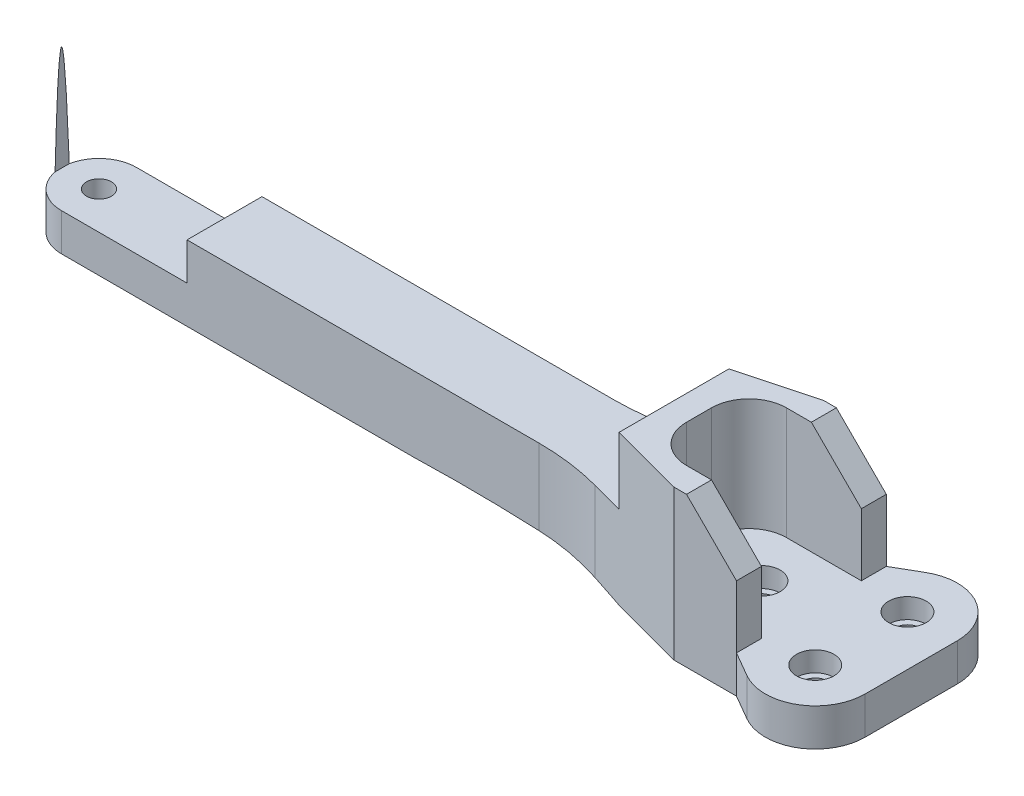
from build123d import *

# Parameters (mm, degrees)
SKETCH1_R                               = 5
BOSS_EXTRUDE1_DEPTH                     = 60
BOSS_EXTRUDE2_START                     = 15
BOSS_EXTRUDE2_DEPTH                     = 15
CBORE_FOR_M5_HEX_HEAD_BOLT1_D           = 10
CBORE_FOR_M5_HEX_HEAD_BOLT1_CBORE_D     = 15
CBORE_FOR_M5_HEX_HEAD_BOLT1_CBORE_DEPTH = 8
CHAMFER1_SIZE                           = 20
CUT_EXTRUDE3_DEPTH                      = 338.769583605


with BuildPart() as part:
    # Sketch1 → Boss-Extrude1 (new body)
    with BuildSketch(Plane(origin=(0, 0, 0), x_dir=(1, 0, 0), z_dir=(0, 1, 0))):
        with BuildLine():
            ThreePointArc((0, 15), (-15, 0), (0, -15))
            Line((0, -15), (179, -15))
            Line((179, -15), (191.125444005, -15))
            ThreePointArc((191.125444005, -15), (204.178063227, -15.855513863), (217.007348515, -18.407417371))
            Line((217.007348515, -18.407417371), (260.271455877, -30))
            Line((260.271455877, -30), (285.271455877, -30))
            Line((285.271455877, -30), (285.271455877, -20))
            Line((285.271455877, -20), (255.271455877, -20))
            ThreePointArc((255.271455877, -20), (244.66485416, -15.606601718), (240.271455877, -5))
            Line((240.271455877, -5), (240.271455877, 5))
            ThreePointArc((240.271455877, 5), (244.66485416, 15.606601718), (255.271455877, 20))
            Line((255.271455877, 20), (285.271455877, 20))
            Line((285.271455877, 20), (285.271455877, 30))
            Line((285.271455877, 30), (260.271455877, 30))
            Line((260.271455877, 30), (217.007348515, 18.407417371))
            ThreePointArc((217.007348515, 18.407417371), (204.178063227, 15.855513863), (191.125444005, 15))
            Line((191.125444005, 15), (0, 15))
        make_face()
        with Locations(Location((0, 0, 0), (0, 0, 270))):
            Circle(SKETCH1_R, mode=Mode.SUBTRACT)
    extrude(amount=-BOSS_EXTRUDE1_DEPTH)

    # Sketch4 → Boss-Extrude2 (add)
    with BuildSketch(Plane(origin=(0, -60, 0), x_dir=(1, 0, 0), z_dir=(0, 1, 0)).offset(BOSS_EXTRUDE2_START)):
        with BuildLine():
            Line((260.271455877, -20), (260.271455877, 20))
            Line((260.271455877, 20), (255.271455877, 20))
            ThreePointArc((255.271455877, 20), (244.66485416, 15.606601718), (240.271455877, 5))
            Line((240.271455877, 5), (240.271455877, -5))
            ThreePointArc((240.271455877, -5), (244.66485416, -15.606601718), (255.271455877, -20))
            Line((255.271455877, -20), (260.271455877, -20))
        make_face()
        with BuildLine():
            Line((325.271455877, -18.46), (325.271455877, 18.46))
            ThreePointArc((325.271455877, 18.46), (315.266904712, 35.783134895), (295.262355618, 35.77525085))
            Line((295.262355618, 35.77525085), (285.271455877, 30))
            Line((285.271455877, 30), (285.271455877, 20))
            Line((285.271455877, 20), (260.271455877, 20))
            Line((260.271455877, 20), (260.271455877, -20))
            Line((260.271455877, -20), (285.271455877, -20))
            Line((285.271455877, -20), (285.271455877, -30))
            Line((285.271455877, -30), (295.262355618, -35.77525085))
            ThreePointArc((295.262355618, -35.77525085), (315.266904712, -35.783134895), (325.271455877, -18.46))
        make_face()
    extrude(amount=-BOSS_EXTRUDE2_DEPTH)

    # CBORE for M5 Hex Head Bolt1 (through all)
    with Locations(Plane(origin=(0, -45, 0), x_dir=(1, 0, 0), z_dir=(0, 1, 0))):
        with Locations((265.271455877, 0), (305.271455877, 18.46), (305.271455877, -18.46)):
            CounterBoreHole(CBORE_FOR_M5_HEX_HEAD_BOLT1_D / 2, CBORE_FOR_M5_HEX_HEAD_BOLT1_CBORE_D / 2, CBORE_FOR_M5_HEX_HEAD_BOLT1_CBORE_DEPTH)

    # Chamfer1
    chamfer1_edges = [part.edges().sort_by_distance(p)[0] for p in [
        (285.271455877, 0, -25),
        (285.271455877, 0, 25),
    ]]
    chamfer(chamfer1_edges, length=CHAMFER1_SIZE)

    # Sketch9 → Cut-Extrude3 (cut, through all)
    with BuildSketch(Plane.XY.offset(30)):
        Polygon((-15, 0), (230.271455877, 0), (230.271455877, -26.768114978), (50.271455877, -26.768114978), (50.271455877, -41.766455786), (-14.728544123, -41.766455786), align=None)
        with BuildLine():
            ThreePointArc((141.259972199, -56.766455786), (185.683449524, -56.91600014), (230, -60))
            Line((230, -60), (-15, -60))
            Line((-15, -60), (-14.728544123, -56.766455786))
            Line((-14.728544123, -56.766455786), (141.259972199, -56.766455786))
        make_face()
    extrude(amount=-CUT_EXTRUDE3_DEPTH, mode=Mode.SUBTRACT)


solid = part.part
